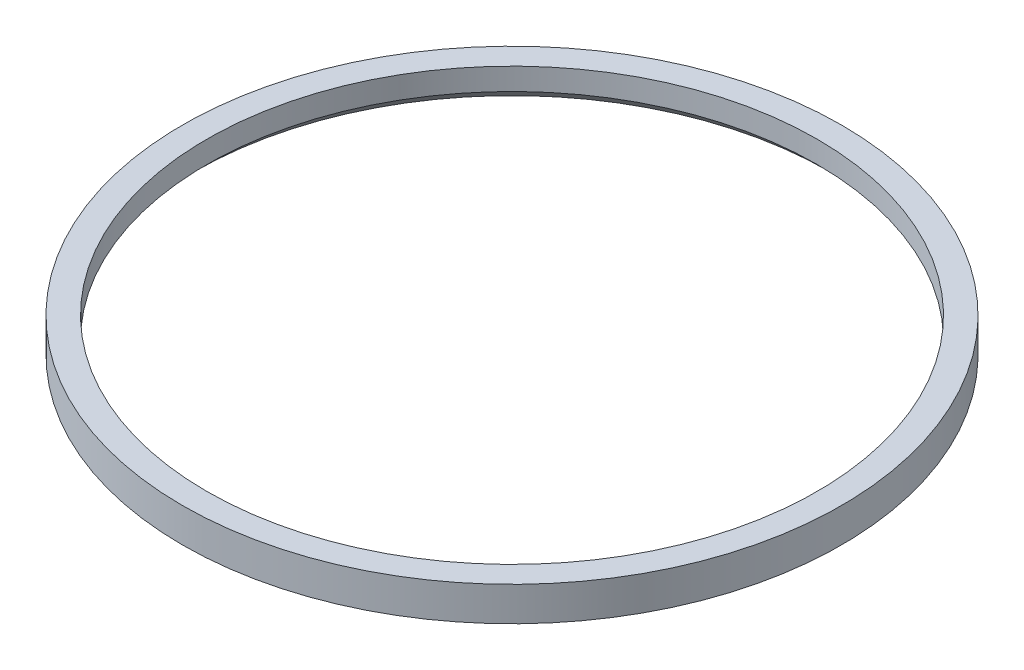
from build123d import *


with BuildPart() as part:
    # Sketch1 → Revolve1 (revolve)
    with BuildSketch(Plane.XY, mode=Mode.PRIVATE) as revolve1_sk:
        Polygon((13, 0.514576605), (12.5, 1.014576605), (12.5, 1.914576605), (13.5, 1.914576605), (13.5, 0.514576605), align=None)
    revolve(revolve1_sk.sketch.rotate(Axis((0, 0, 0), (0, 1, 0)), 90), axis=Axis((0, 0, 0), (0, 1, 0)))


solid = part.part
